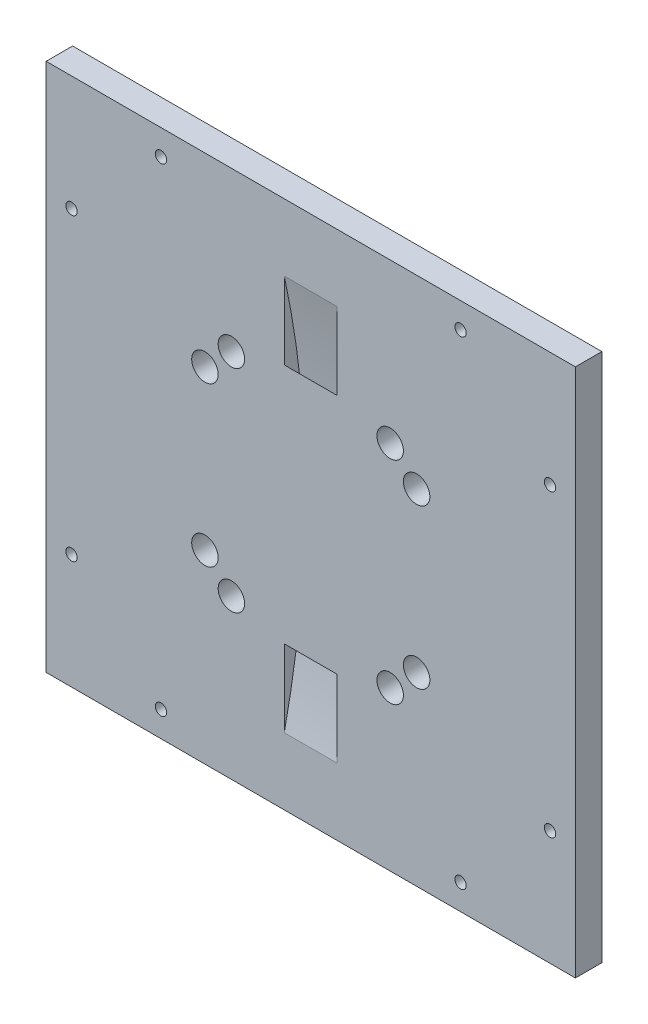
from build123d import *

# Parameters (mm, degrees)
SKETCH1_W           = 200
SKETCH1_H           = 200
BOSS_EXTRUDE1_DEPTH = 10
SKETCH2_R           = 5
SKETCH2_R_2         = 2.15
CUT_EXTRUDE1_DEPTH  = 142.774468788
SKETCH3_W           = 20
SKETCH3_H           = 5


with BuildPart() as part:
    # Sketch1 → Boss-Extrude1 (new body)
    with BuildSketch(Plane.XY):
        Rectangle(SKETCH1_W, SKETCH1_H)
    extrude(amount=BOSS_EXTRUDE1_DEPTH)

    # Sketch2 → Cut-Extrude1 (cut, through all)
    with BuildSketch(Plane.XY.offset(10)):
        with Locations((-40, 30)):
            Circle(SKETCH2_R)
        with Locations((40, 30)):
            Circle(SKETCH2_R)
        with Locations((40, -30)):
            Circle(SKETCH2_R)
        with Locations((-40, -30)):
            Circle(SKETCH2_R)
        with Locations((-30, 40)):
            Circle(SKETCH2_R)
        with Locations((30, 40)):
            Circle(SKETCH2_R)
        with Locations((30, -40)):
            Circle(SKETCH2_R)
        with Locations((-30, -40)):
            Circle(SKETCH2_R)
        with Locations((-56.6, 90.4)):
            Circle(SKETCH2_R_2)
        with Locations((-90.4, 56.6)):
            Circle(SKETCH2_R_2)
        with Locations((-90.4, -56.6)):
            Circle(SKETCH2_R_2)
        with Locations((-56.6, -90.4)):
            Circle(SKETCH2_R_2)
        with Locations((56.6, -90.4)):
            Circle(SKETCH2_R_2)
        with Locations((90.4, -56.6)):
            Circle(SKETCH2_R_2)
        with Locations((90.4, 56.6)):
            Circle(SKETCH2_R_2)
        with Locations((56.6, 90.4)):
            Circle(SKETCH2_R_2)
    extrude(amount=-CUT_EXTRUDE1_DEPTH, mode=Mode.SUBTRACT)

    # Sketch3 → Cut-Revolve1 (revolve, cut)
    with BuildSketch(Plane(origin=(0, 0, 0), x_dir=(1, 0, 0), z_dir=(0, 1, 0))):
        with Locations((0, -4.492265688)):
            Rectangle(SKETCH3_W, SKETCH3_H)
    revolve(axis=Axis((0, 0, 354.492265688), (1, 0, 0)), mode=Mode.SUBTRACT)


solid = part.part
